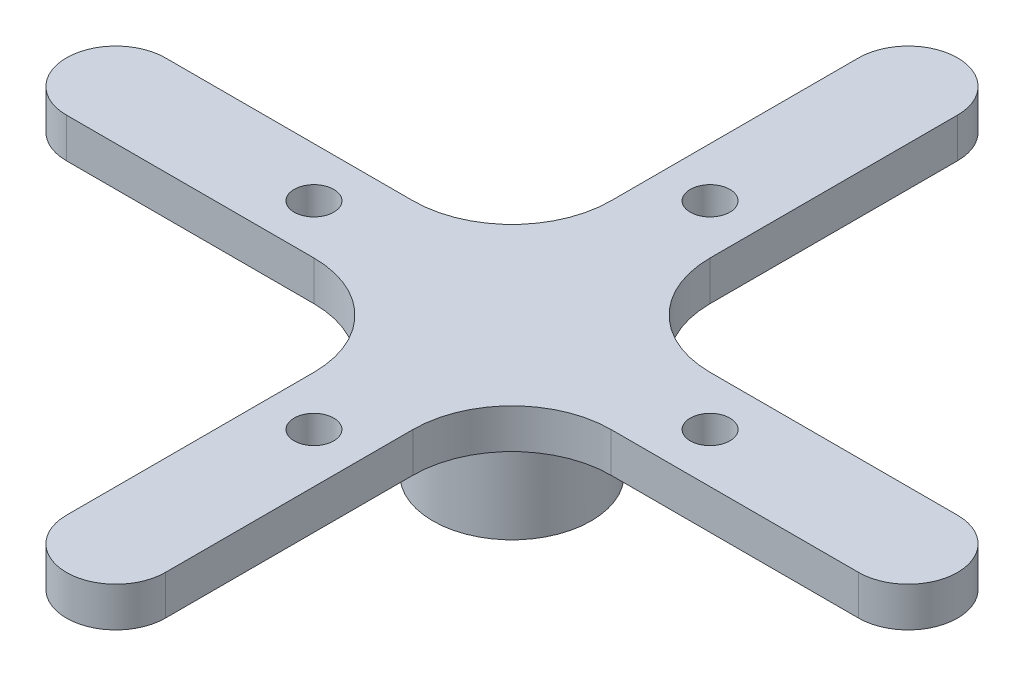
from build123d import *

# Parameters (mm, degrees)
SKETCH1_R           = 1
BOSS_EXTRUDE1_DEPTH = 2
SKETCH2_R           = 4
SKETCH2_R_2         = 2.95
BOSS_EXTRUDE2_DEPTH = 5


with BuildPart() as part:
    # Sketch1 → Boss-Extrude1 (new body)
    with BuildSketch(Plane(origin=(0, 0, 0), x_dir=(1, 0, 0), z_dir=(0, 1, 0))):
        with BuildLine():
            Line((2.5, 20), (2.5, 7.5))
            ThreePointArc((2.5, 7.5), (3.964466094, 3.964466094), (7.5, 2.5))
            Line((7.5, 2.5), (20, 2.5))
            ThreePointArc((20, 2.5), (22.5, 0), (20, -2.5))
            Line((20, -2.5), (7.5, -2.5))
            ThreePointArc((7.5, -2.5), (3.964466094, -3.964466094), (2.5, -7.5))
            Line((2.5, -7.5), (2.5, -20))
            ThreePointArc((2.5, -20), (0, -22.5), (-2.5, -20))
            Line((-2.5, -20), (-2.5, -7.5))
            ThreePointArc((-2.5, -7.5), (-3.964466094, -3.964466094), (-7.5, -2.5))
            Line((-7.5, -2.5), (-20, -2.5))
            ThreePointArc((-20, -2.5), (-22.5, 0), (-20, 2.5))
            Line((-20, 2.5), (-7.5, 2.5))
            ThreePointArc((-7.5, 2.5), (-3.964466094, 3.964466094), (-2.5, 7.5))
            Line((-2.5, 7.5), (-2.5, 20))
            ThreePointArc((-2.5, 20), (0, 22.5), (2.5, 20))
        make_face()
        with Locations(Location((10, 0, 0), (0, 0, 270))):
            Circle(SKETCH1_R, mode=Mode.SUBTRACT)
        with Locations(Location((-10, 0, 0), (0, 0, 270))):
            Circle(SKETCH1_R, mode=Mode.SUBTRACT)
        with Locations(Location((0, 10, 0), (0, 0, 270))):
            Circle(SKETCH1_R, mode=Mode.SUBTRACT)
        with Locations(Location((0, -10, 0), (0, 0, 270))):
            Circle(SKETCH1_R, mode=Mode.SUBTRACT)
    extrude(amount=BOSS_EXTRUDE1_DEPTH)

    # Sketch2 → Boss-Extrude2 (add)
    with BuildSketch(Plane.XZ):
        with Locations(Location((0, 0, 0), (0, 0, 90))):
            Circle(SKETCH2_R)
        with Locations(Location((0, 0, 0), (0, 0, 270))):
            Circle(SKETCH2_R_2, mode=Mode.SUBTRACT)
    extrude(amount=BOSS_EXTRUDE2_DEPTH)


solid = part.part
